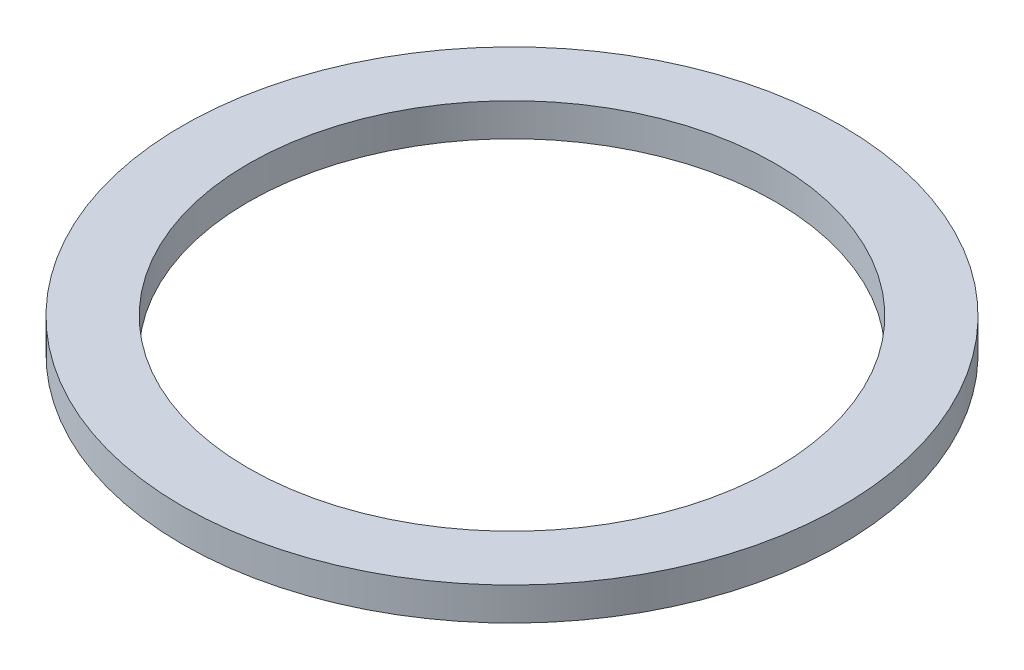
from build123d import *

# Parameters (mm, degrees)
SKETCH1_R           = 50
SKETCH1_R_2         = 40
BOSS_EXTRUDE1_DEPTH = 5


with BuildPart() as part:
    # Sketch1 → Boss-Extrude1 (new body)
    with BuildSketch(Plane(origin=(0, 0, 0), x_dir=(1, 0, 0), z_dir=(0, 1, 0))):
        with Locations(Location((0, 0, 0), (0, 0, 270))):
            Circle(SKETCH1_R)
        with Locations(Location((0, 0, 0), (0, 0, 270))):
            Circle(SKETCH1_R_2, mode=Mode.SUBTRACT)
    extrude(amount=BOSS_EXTRUDE1_DEPTH)


solid = part.part
